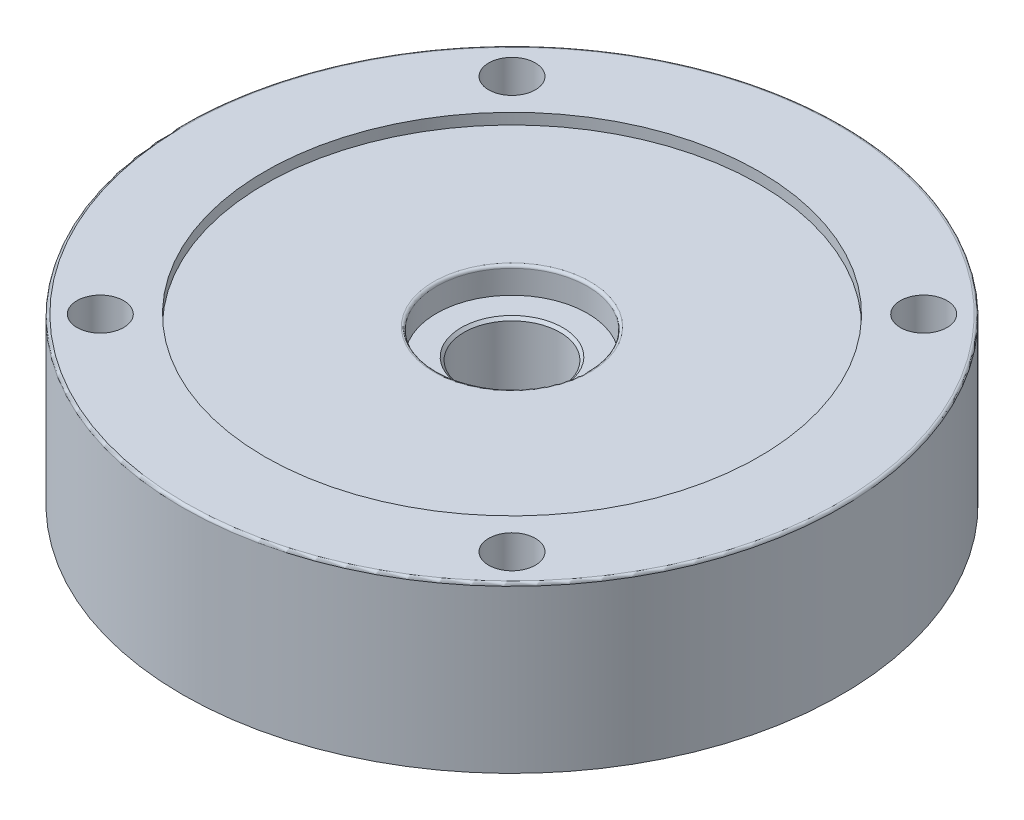
from build123d import *

# Parameters (mm, degrees)
SKETCH2_R          = 8.5
CUT_EXTRUDE1_DEPTH = 181
FILLET1_R          = 1
CHAMFER1_SIZE      = 1


with BuildPart() as part:
    # Sketch1 → Revolve1 (revolve)
    with BuildSketch(Plane.XY):
        Polygon((27.5, 9.5), (27.5, 0), (120, 0), (120, 60), (90, 60), (90, 56), (27.5, 56), (27.5, 46.5), (17.5, 46.5), (17.5, 9.5), align=None)
    revolve(axis=Axis((0, 0, 0), (0, 1, 0)))

    # Sketch2 → Cut-Extrude1 (cut, through all)
    with BuildSketch(Plane(origin=(0, 60, 0), x_dir=(1, 0, 0), z_dir=(0, 1, 0))):
        with Locations((-74.953318805, 74.953318805)):
            Circle(SKETCH2_R)
        with Locations((74.953318805, 74.953318805)):
            Circle(SKETCH2_R)
        with Locations((74.953318805, -74.953318805)):
            Circle(SKETCH2_R)
        with Locations((-74.953318805, -74.953318805)):
            Circle(SKETCH2_R)
    extrude(amount=-CUT_EXTRUDE1_DEPTH, mode=Mode.SUBTRACT)

    # Fillet1
    fillet1_edges = [part.edges().sort_by_distance(p)[0] for p in [
        (-27.5, 56, 0),
        (-120, 60, 0),
    ]]
    fillet(fillet1_edges, radius=FILLET1_R)

    # Chamfer1
    chamfer1_edges = [part.edges().sort_by_distance(p)[0] for p in [
        (-17.5, 9.5, 0),
        (-17.5, 46.5, 0),
    ]]
    chamfer(chamfer1_edges, length=CHAMFER1_SIZE)


solid = part.part
